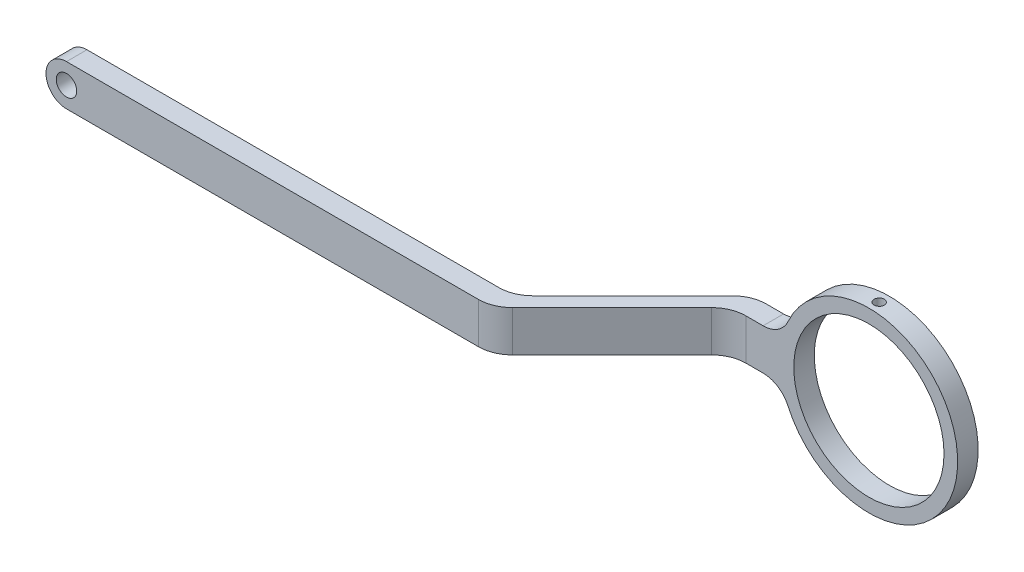
from build123d import *

# Parameters (mm, degrees)
BOSS_EXTRUDE1_DEPTH = 76.2
FILLET1_R           = 127
CUT_EXTRUDE1_DEPTH  = 152.4
SKETCH3_R           = 38.1
CUT_EXTRUDE2_DEPTH  = 152.4
SKETCH4_R           = 330.2
SKETCH4_R_2         = 279.4
BOSS_EXTRUDE2_DEPTH = 76.2
CUT_EXTRUDE3_DEPTH  = 76.2
FILLET2_R           = 101.6
SKETCH9_R           = 19.05
CUT_EXTRUDE4_DEPTH  = 2196.137597601


with BuildPart() as part:
    # Sketch1 → Boss-Extrude1 (new, symmetric)
    with BuildSketch(Plane(origin=(0, 0, 0), x_dir=(1, 0, 0), z_dir=(0, 1, 0))):
        Polygon((830.58, 38.1), (1275.08, 482.6), (2115.82, 482.6), (2115.82, 406.4), (1275.08, 406.4), (830.58, -38.1), (-830.58, -38.1), (-830.58, 38.1), align=None)
    extrude(amount=BOSS_EXTRUDE1_DEPTH, both=True)

    # Fillet1
    fillet1_edges = [part.edges().sort_by_distance(p)[0] for p in [
        (830.58, 0, -38.1),
        (1275.08, 0, -482.6),
        (1275.08, 0, -406.4),
        (830.58, 0, 38.1),
    ]]
    fillet(fillet1_edges, radius=FILLET1_R)

    # Sketch2 → Cut-Extrude1 (cut)
    with BuildSketch(Plane.XY.offset(38.1)):
        with BuildLine():
            ThreePointArc((-830.58, -4.12e-07), (-808.261536872, 53.881536581), (-754.38, 76.2))
            Line((-754.38, 76.2), (-830.58, 76.2))
            Line((-830.58, 76.2), (-830.58, -4.12e-07))
        make_face()
        with BuildLine():
            ThreePointArc((-754.38, -76.2), (-808.261536581, -53.881536872), (-830.58, -4.12e-07))
            Line((-830.58, -4.12e-07), (-830.58, -76.2))
            Line((-830.58, -76.2), (-754.38, -76.2))
        make_face()
    extrude(amount=-CUT_EXTRUDE1_DEPTH, mode=Mode.SUBTRACT)

    # Sketch3 → Cut-Extrude2 (cut)
    with BuildSketch(Plane.XY.offset(38.1)):
        with Locations((-754.38, 0)):
            Circle(SKETCH3_R)
    extrude(amount=-CUT_EXTRUDE2_DEPTH, mode=Mode.SUBTRACT)

    # Sketch4 → Boss-Extrude2 (add)
    with BuildSketch(Plane.XY.offset(-406.4)):
        with Locations((1785.62, 0)):
            Circle(SKETCH4_R)
        with Locations((1785.62, 0)):
            Circle(SKETCH4_R_2, mode=Mode.SUBTRACT)
    extrude(amount=-BOSS_EXTRUDE2_DEPTH)

    # Sketch5 → Cut-Extrude3 (cut)
    with BuildSketch(Plane.XY.offset(-406.4)):
        with BuildLine():
            ThreePointArc((2054.428333204, -76.2), (2062.359415604, -38.466295005), (2065.02, 0))
            ThreePointArc((2065.02, 0), (2062.359415604, 38.466295005), (2054.428333204, 76.2))
            Line((2054.428333204, 76.2), (1516.811666796, 76.2))
            ThreePointArc((1516.811666796, 76.2), (1506.22, 0), (1516.811666796, -76.2))
            Line((1516.811666796, -76.2), (2054.428333204, -76.2))
        make_face()
        with BuildLine():
            Line((2115.82, 76.2), (2106.907410273, 76.2))
            ThreePointArc((2106.907410273, 76.2), (2113.584283781, 38.359725806), (2115.82, 0))
            Line((2115.82, 0), (2115.82, 76.2))
        make_face()
        with BuildLine():
            Line((2115.82, -76.2), (2115.82, 0))
            ThreePointArc((2115.82, 0), (2113.584283781, -38.359725806), (2106.907410273, -76.2))
            Line((2106.907410273, -76.2), (2115.82, -76.2))
        make_face()
    extrude(amount=-CUT_EXTRUDE3_DEPTH, mode=Mode.SUBTRACT)

    # Fillet2
    fillet2_edges = [part.edges().sort_by_distance(p)[0] for p in [
        (1464.332589727, -76.2, -444.5),
        (1464.332589727, 76.2, -444.5),
    ]]
    fillet(fillet2_edges, radius=FILLET2_R)

    # Sketch9 → Cut-Extrude4 (cut, through all)
    with BuildSketch(Plane(origin=(0, 0, 0), x_dir=(1, 0, 0), z_dir=(0, 1, 0))):
        with Locations(Location((1785.62, 444.5, 0), (0, 0, 90))):
            Circle(SKETCH9_R)
    extrude(amount=CUT_EXTRUDE4_DEPTH, mode=Mode.SUBTRACT)


solid = part.part
